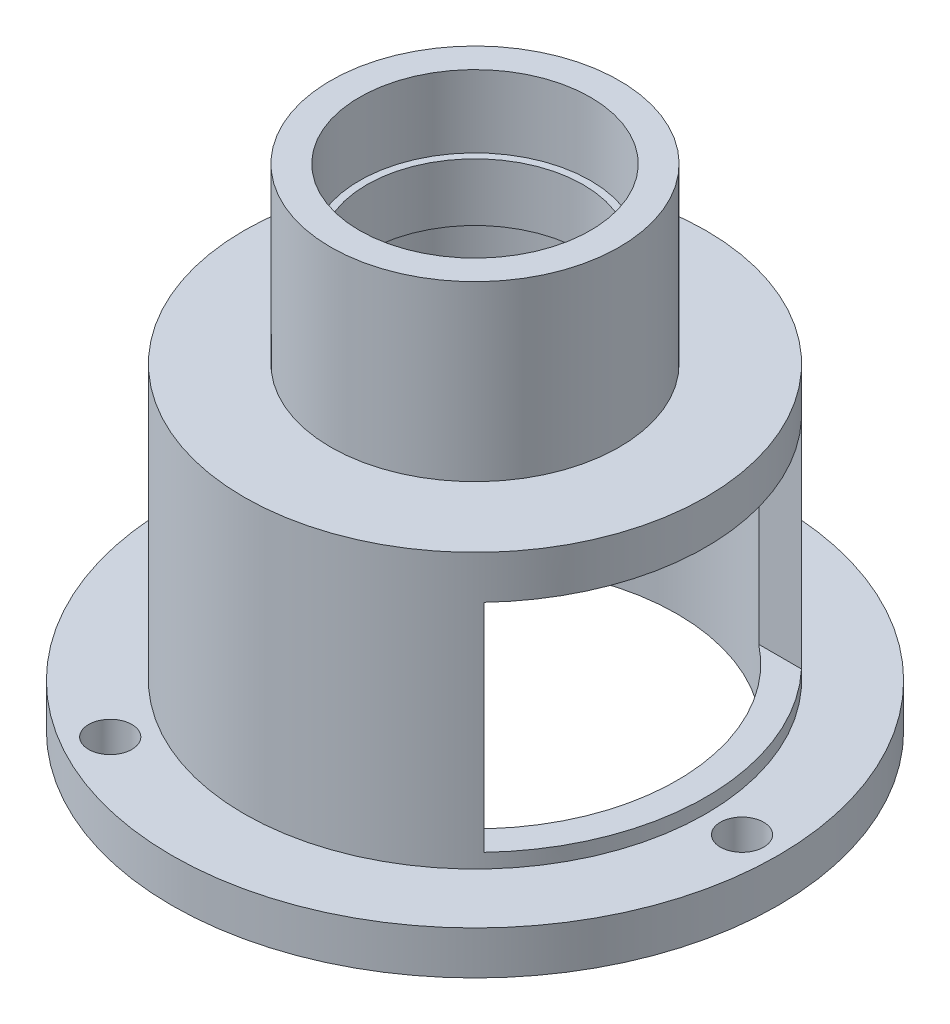
from build123d import *

# Parameters (mm, degrees)
SKETCH_1_R          = 16
SKETCH_1_R_2        = 8
EXTRUDE_1_DEPTH     = 14
SKETCH_2_R          = 20
SKETCH_2_R_2        = 10
CUT_EXTRUDE_1_DEPTH = 12
EXTRUDE_START       = -5
SKETCH_4_R          = 9.5
SKETCH_4_R_2        = 7.5
EXTRUDE_2_DEPTH     = 4
EXTRUDE_START_2     = 17
SKETCH_6_R          = 16
SKETCH_6_R_2        = 14
EXTRUDE_3_DEPTH     = 17
EXTRUDE_START_3     = 3
SKETCH_7_R          = 21
SKETCH_7_R_2        = 14
EXTRUDE_4_DEPTH     = 3
SKETCH_8_R          = 1.5
CUT_EXTRUDE_4_DEPTH = 10
SKETCH_11_W         = 15
SKETCH_11_H         = 15
CUT_EXTRUDE_5_DEPTH = 11


with BuildPart() as part:
    # 草图1 → 凸台-拉伸1 (new body)
    with BuildSketch(Plane(origin=(0, 0, 0), x_dir=(1, 0, 0), z_dir=(0, 1, 0))):
        with Locations(Location((0, 0, 0), (0, 0, 270))):
            Circle(SKETCH_1_R)
        with Locations(Location((0, 0, 0), (0, 0, 270))):
            Circle(SKETCH_1_R_2, mode=Mode.SUBTRACT)
    extrude(amount=EXTRUDE_1_DEPTH)

    # 草图2 → 切除-拉伸1 (cut)
    with BuildSketch(Plane(origin=(0, 14, 0), x_dir=(1, 0, 0), z_dir=(0, 1, 0))):
        Circle(SKETCH_2_R)
        with Locations(Location((0, 0, 0), (0, 0, 270))):
            Circle(SKETCH_2_R_2, mode=Mode.SUBTRACT)
    extrude(amount=-CUT_EXTRUDE_1_DEPTH, mode=Mode.SUBTRACT)

    # 草图4 → 凸台-拉伸2 (add)
    with BuildSketch(Plane.XZ.offset(EXTRUDE_START)):
        Circle(SKETCH_4_R)
        with Locations(Location((0, 0, 0), (0, 0, 270))):
            Circle(SKETCH_4_R_2, mode=Mode.SUBTRACT)
    extrude(amount=-EXTRUDE_2_DEPTH)

    # 草图6 → 凸台-拉伸3 (add)
    with BuildSketch(Plane.XZ.offset(EXTRUDE_START_2)):
        with Locations(Location((0, 0, 0), (0, 0, 270))):
            Circle(SKETCH_6_R)
        with Locations(Location((0, 0, 0), (0, 0, 270))):
            Circle(SKETCH_6_R_2, mode=Mode.SUBTRACT)
    extrude(amount=-EXTRUDE_3_DEPTH)

    # 草图7 → 凸台-拉伸4 (add)
    with BuildSketch(Plane.XZ.offset(17).offset(EXTRUDE_START_3)):
        with Locations(Location((0, 0, 0), (0, 0, 270))):
            Circle(SKETCH_7_R)
        with Locations(Location((0, 0, 0), (0, 0, 270))):
            Circle(SKETCH_7_R_2, mode=Mode.SUBTRACT)
    extrude(amount=-EXTRUDE_4_DEPTH)

    # 草图8 → 切除-拉伸4 (cut)
    with BuildSketch(Plane(origin=(0, -17, 0), x_dir=(1, 0, 0), z_dir=(0, 1, 0))):
        with Locations(Location((18.5, 0, 0), (0, 0, 270))):
            Circle(SKETCH_8_R)
        with Locations(Location((-9.25, -16.02146997, 0), (0, 0, 270))):
            Circle(SKETCH_8_R)
        with Locations(Location((-9.25, 16.02146997, 0), (0, 0, 270))):
            Circle(SKETCH_8_R)
    extrude(amount=-CUT_EXTRUDE_4_DEPTH, mode=Mode.SUBTRACT)

    # 草图11 → 切除-拉伸5 (cut, symmetric)
    with BuildSketch(Plane.XY):
        with Locations((-8.5, -8.5)):
            Rectangle(SKETCH_11_W, SKETCH_11_H)
    cut_extrude_5 = extrude(amount=CUT_EXTRUDE_5_DEPTH, both=True, mode=Mode.SUBTRACT)

    # 镜向1: 切除-拉伸5 across plane
    add(cut_extrude_5.mirror(Plane(origin=(0, 0, 0), x_dir=(0, 0, 1), z_dir=(1, 0, 0))), mode=Mode.SUBTRACT)


solid = part.part
